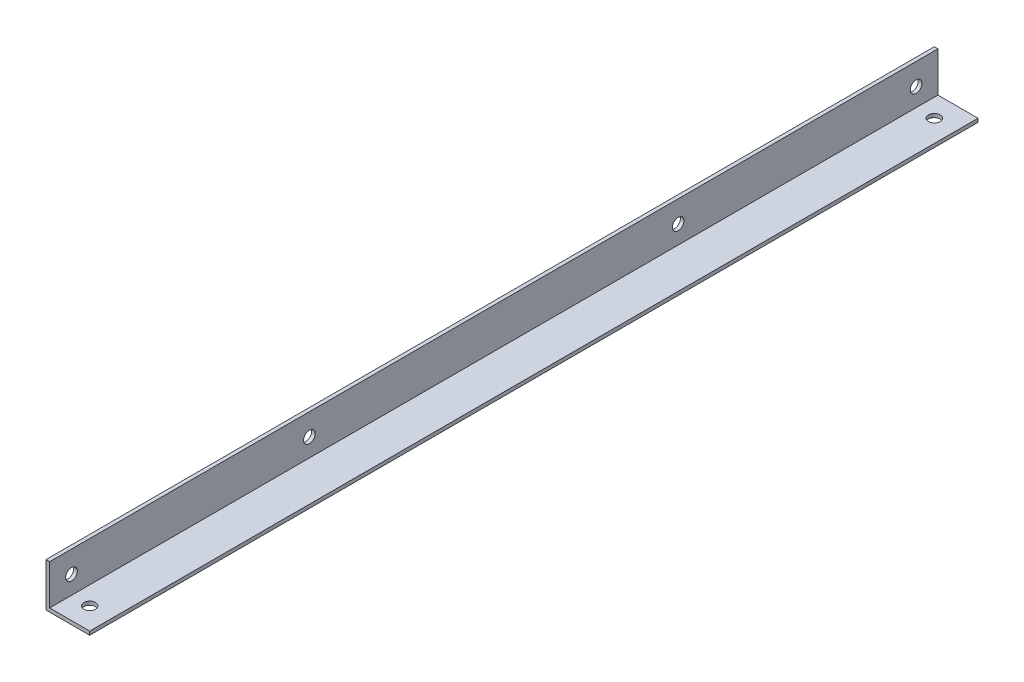
from build123d import *

# Parameters (mm, degrees)
BOSS_EXTRUDE1_DEPTH = 609.6
SKETCH2_R           = 4
CUT_EXTRUDE1_DEPTH  = 611.956962478
SKETCH3_R           = 4
CUT_EXTRUDE2_DEPTH  = 611.956962478


with BuildPart() as part:
    # Sketch1 → Boss-Extrude1 (new body)
    with BuildSketch(Plane.XY):
        Polygon((0, 0), (0, 30), (2.5, 30), (2.5, 2.5), (30, 2.5), (30, 0), align=None)
    extrude(amount=BOSS_EXTRUDE1_DEPTH)

    # Sketch2 → Cut-Extrude1 (cut, through all)
    with BuildSketch(Plane(origin=(2.5, 0, 0), x_dir=(0, 0, -1), z_dir=(1, 0, 0))):
        with Locations(Location((-594.6, 15, 0), (0, 0, 90))):
            Circle(SKETCH2_R)
        with Locations(Location((-15, 15, 0), (0, 0, 270))):
            Circle(SKETCH2_R)
        with Locations(Location((-431.3434763, 15, 0), (0, 0, 90))):
            Circle(SKETCH2_R)
        with Locations(Location((-178.2565237, 15, 0), (0, 0, 270))):
            Circle(SKETCH2_R)
    extrude(amount=-CUT_EXTRUDE1_DEPTH, mode=Mode.SUBTRACT)

    # Sketch3 → Cut-Extrude2 (cut, through all)
    with BuildSketch(Plane(origin=(0, 2.5, 0), x_dir=(1, 0, 0), z_dir=(0, 1, 0))):
        with Locations(Location((15, -15, 0), (0, 0, 180))):
            Circle(SKETCH3_R)
        with Locations(Location((15, -594.6, 0), (0, 0, 180))):
            Circle(SKETCH3_R)
    extrude(amount=-CUT_EXTRUDE2_DEPTH, mode=Mode.SUBTRACT)


solid = part.part
